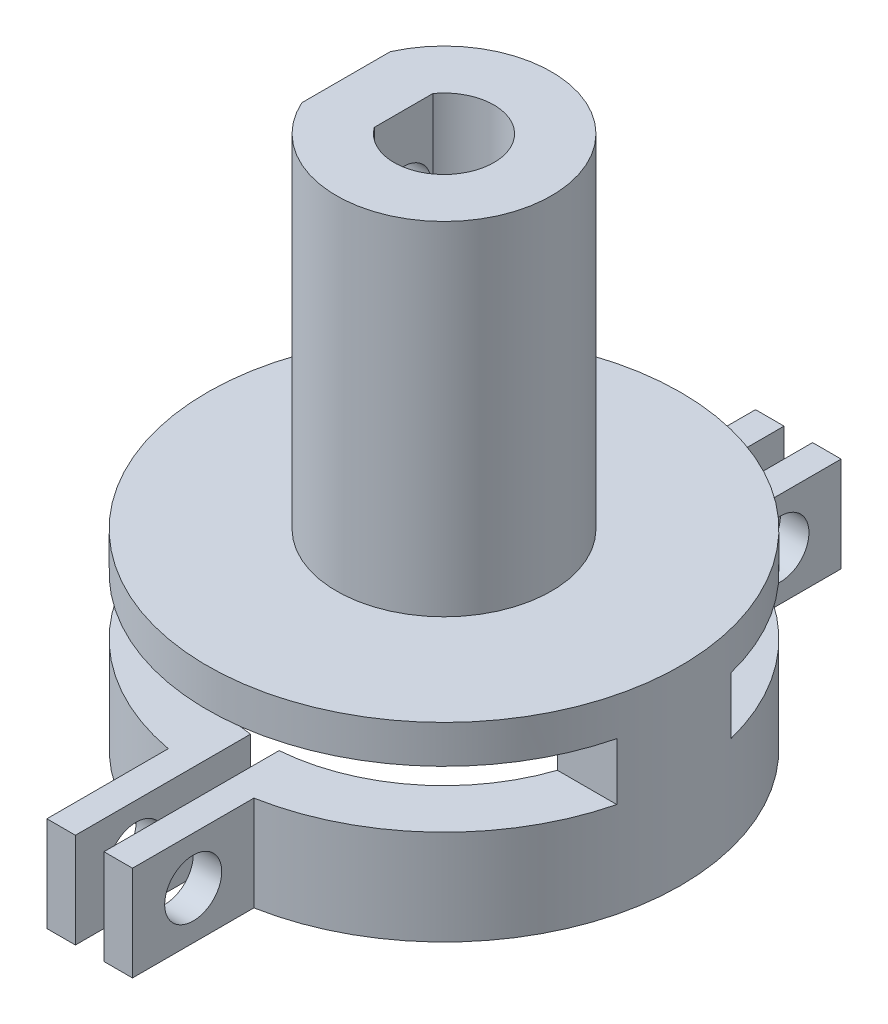
from build123d import *

# Parameters (mm, degrees)
BOSS_EXTRUDE1_DEPTH = 18
SKETCH2_R           = 12.45
SKETCH2_R_2         = 9.45
BOSS_EXTRUDE2_DEPTH = 10
SKETCH3_R           = 12.45
BOSS_EXTRUDE3_DEPTH = 2
CUT_EXTRUDE1_REACH  = 30.085
SKETCH4_R           = 1.45
CUT_EXTRUDE2_START  = -8
CUT_EXTRUDE2_DEPTH  = 3
CUT_EXTRUDE3_REACH  = 35.076
BOSS_EXTRUDE4_START = -5
BOSS_EXTRUDE4_DEPTH = 5
SKETCH8_R           = 1.5
CUT_EXTRUDE4_DEPTH  = 30.783714089


with BuildPart() as part:
    # Sketch1 → Boss-Extrude1 (new body)
    with BuildSketch(Plane(origin=(0, 0, 0), x_dir=(1, 0, 0), z_dir=(0, 1, 0))):
        with BuildLine():
            Line((-5.149418526, 2.325078245), (-5.149418526, -2.325078245))
            ThreePointArc((-5.149418526, -2.325078245), (5.65, 0), (-5.149418526, 2.325078245))
        make_face()
        with BuildLine():
            Line((-2.124418526, 1.541904967), (-2.124418526, -1.541904967))
            ThreePointArc((-2.124418526, -1.541904967), (2.625, 0), (-2.124418526, 1.541904967))
        make_face(mode=Mode.SUBTRACT)
    extrude(amount=BOSS_EXTRUDE1_DEPTH)



with BuildPart() as body_2:
    # Sketch2 → Boss-Extrude2 (new body)
    with BuildSketch(Plane.XZ):
        with Locations(Location((0, 0, 0), (0, 0, 270))):
            Circle(SKETCH2_R)
        with Locations(Location((0, 0, 0), (0, 0, 270))):
            Circle(SKETCH2_R_2, mode=Mode.SUBTRACT)
    extrude(amount=BOSS_EXTRUDE2_DEPTH)


with BuildPart() as part_1:
    add(part.part)

    add(body_2.part)  # Boss-Extrude3 merges body 2
    # Sketch3 → Boss-Extrude3 (add)
    with BuildSketch(Plane.XZ):
        with Locations(Location((0, 0, 0), (0, 0, 270))):
            Circle(SKETCH3_R)
    extrude(amount=BOSS_EXTRUDE3_DEPTH)

    # Sketch4 → Cut-Extrude1 (cut, up to next)
    with BuildSketch(Plane.ZY.offset(5.149418526), mode=Mode.PRIVATE) as cut_extrude1_sk1:
        with Locations((0, 14)):
            Circle(SKETCH4_R)
    cut_extrude1_tool1 = extrude(cut_extrude1_sk1.sketch, amount=-CUT_EXTRUDE1_REACH, mode=Mode.PRIVATE) & part_1.part
    # Sketch4 → Cut-Extrude1 (cut, up to next)
    with BuildSketch(Plane.ZY.offset(5.149418526), mode=Mode.PRIVATE) as cut_extrude1_sk2:
        with Locations((0, 4)):
            Circle(SKETCH4_R)
    cut_extrude1_tool2 = extrude(cut_extrude1_sk2.sketch, amount=-CUT_EXTRUDE1_REACH, mode=Mode.PRIVATE) & part_1.part
    add(cut_extrude1_tool1.solids().sort_by_distance((-5.149419, 14, 0))[0], mode=Mode.SUBTRACT)
    add(cut_extrude1_tool2.solids().sort_by_distance((-5.149419, 4, 0))[0], mode=Mode.SUBTRACT)

    # Sketch5 → Cut-Extrude2 (cut)
    with BuildSketch(Plane.XZ.offset(10).offset(CUT_EXTRUDE2_START)):
        with BuildLine():
            Line((-8.961166219, 3), (-12.083149424, 3))
            ThreePointArc((-12.083149424, 3), (0, 12.45), (12.083149424, 3))
            Line((12.083149424, 3), (8.961166219, 3))
            ThreePointArc((8.961166219, 3), (0, 9.45), (-8.961166219, 3))
        make_face()
        with BuildLine():
            Line((-8.961166219, -3), (-12.083149424, -3))
            ThreePointArc((-12.083149424, -3), (0, -12.45), (12.083149424, -3))
            Line((12.083149424, -3), (8.961166219, -3))
            ThreePointArc((8.961166219, -3), (0, -9.45), (-8.961166219, -3))
        make_face()
    extrude(amount=CUT_EXTRUDE2_DEPTH, mode=Mode.SUBTRACT)

    # Sketch6 → Cut-Extrude3 (cut, up to next)
    with BuildSketch(Plane.XZ.offset(10), mode=Mode.PRIVATE) as cut_extrude3_sk1:
        with BuildLine():
            Line((0.75, 9.420191081), (0.75, 12.427389106))
            ThreePointArc((0.75, 12.427389106), (0, 12.45), (-0.75, 12.427389106))
            Line((-0.75, 12.427389106), (-0.75, 9.420191081))
            ThreePointArc((-0.75, 9.420191081), (0, 9.45), (0.75, 9.420191081))
        make_face()
    cut_extrude3_tool1 = extrude(cut_extrude3_sk1.sketch, amount=-CUT_EXTRUDE3_REACH, mode=Mode.PRIVATE) & part_1.part
    # Sketch6 → Cut-Extrude3 (cut, up to next)
    with BuildSketch(Plane.XZ.offset(10), mode=Mode.PRIVATE) as cut_extrude3_sk2:
        with BuildLine():
            Line((0.75, -9.420191081), (0.75, -12.427389106))
            ThreePointArc((0.75, -12.427389106), (0, -12.45), (-0.75, -12.427389106))
            Line((-0.75, -12.427389106), (-0.75, -9.420191081))
            ThreePointArc((-0.75, -9.420191081), (0, -9.45), (0.75, -9.420191081))
        make_face()
    cut_extrude3_tool2 = extrude(cut_extrude3_sk2.sketch, amount=-CUT_EXTRUDE3_REACH, mode=Mode.PRIVATE) & part_1.part
    add(cut_extrude3_tool1.solids().sort_by_distance((0, -10, 10.941262))[0], mode=Mode.SUBTRACT)
    add(cut_extrude3_tool2.solids().sort_by_distance((0, -10, -10.941262))[0], mode=Mode.SUBTRACT)

    # Sketch7 → Boss-Extrude4 (add)
    with BuildSketch(Plane.XZ.offset(10).offset(BOSS_EXTRUDE4_START)):
        with BuildLine():
            ThreePointArc((-2.25, 12.244998979), (-1.502769623, 12.35897178), (-0.75, 12.427389106))
            Line((-0.75, 12.427389106), (-0.75, 18.627389106))
            Line((-0.75, 18.627389106), (-2.25, 18.627389106))
            Line((-2.25, 18.627389106), (-2.25, 12.244998979))
        make_face()
        with BuildLine():
            Line((2.25, 12.244998979), (2.25, 18.627389106))
            Line((2.25, 18.627389106), (0.75, 18.627389106))
            Line((0.75, 18.627389106), (0.75, 12.427389106))
            ThreePointArc((0.75, 12.427389106), (1.502769623, 12.35897178), (2.25, 12.244998979))
        make_face()
        with BuildLine():
            ThreePointArc((-0.75, -12.427389106), (-1.502769623, -12.35897178), (-2.25, -12.244998979))
            Line((-2.25, -12.244998979), (-2.25, -18.627389106))
            Line((-2.25, -18.627389106), (-0.75, -18.627389106))
            Line((-0.75, -18.627389106), (-0.75, -12.427389106))
        make_face()
        with BuildLine():
            Line((2.25, -18.627389106), (2.25, -12.244998979))
            ThreePointArc((2.25, -12.244998979), (1.502769623, -12.35897178), (0.75, -12.427389106))
            Line((0.75, -12.427389106), (0.75, -18.627389106))
            Line((0.75, -18.627389106), (2.25, -18.627389106))
        make_face()
    extrude(amount=BOSS_EXTRUDE4_DEPTH)

    # Sketch8 → Cut-Extrude4 (cut, through all)
    with BuildSketch(Plane.ZY.offset(2.25)):
        with Locations(Location((-15.436194043, -7.5, 0), (0, 0, 180))):
            Circle(SKETCH8_R)
        with Locations((15.436194043, -7.5)):
            Circle(SKETCH8_R)
    extrude(amount=-CUT_EXTRUDE4_DEPTH, mode=Mode.SUBTRACT)


solid = part_1.part
